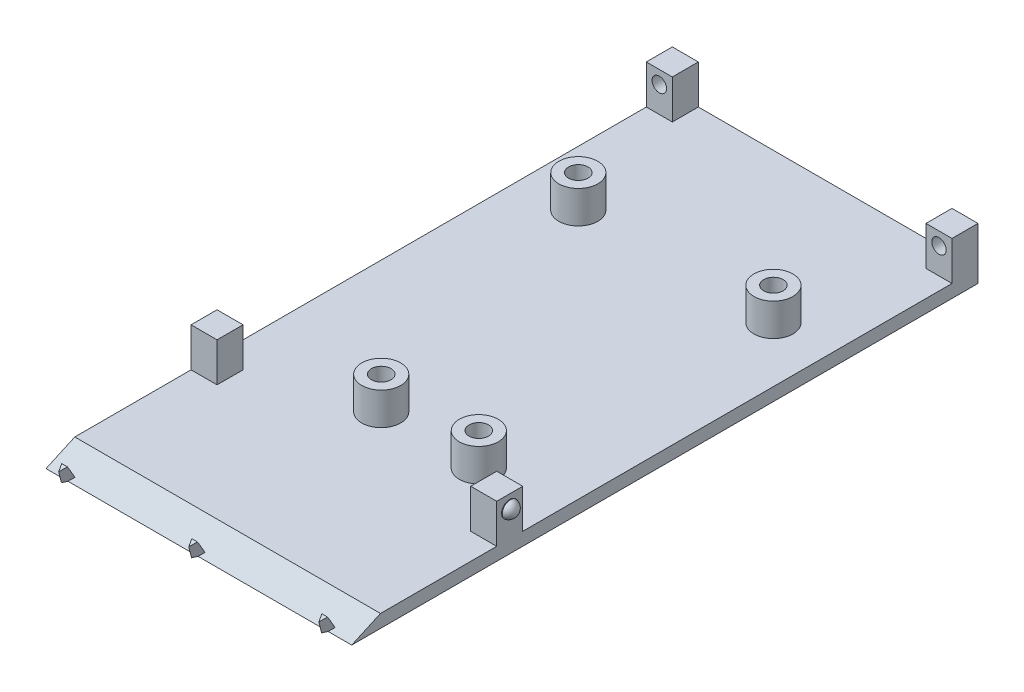
from build123d import *

# Parameters (mm, degrees)
IZIM1_W                               = 47
IZIM1_H                               = 96.3
Y_KSEKLIK_EKSTR_ZYON1_DEPTH           = 2
KES_EKSTR_ZYON1_DEPTH                 = 68.315841375
IZIM3_R                               = 3
Y_KSEKLIK_EKSTR_ZYON2_DEPTH           = 5
Y_KSEKLIK_EKSTR_ZYON3_DEPTH           = 2
Y_KSEKLIK_EKSTR_ZYON3_DRAFT           = 4
Y_KSEKLIK_EKSTR_ZYON3_PROFILE_2_DEPTH = 2
Y_KSEKLIK_EKSTR_ZYON3_PROFILE_2_DRAFT = 4
Y_KSEKLIK_EKSTR_ZYON3_PROFILE_3_DEPTH = 2
Y_KSEKLIK_EKSTR_ZYON3_PROFILE_3_DRAFT = 4
IZIM5_W                               = 47
IZIM5_H                               = 2.496748802
KES_EKSTR_ZYON3_DEPTH                 = 4
IZIM6_W                               = 4
IZIM6_H                               = 4
Y_KSEKLIK_EKSTR_ZYON4_DEPTH           = 6
IZIM7_R                               = 1.25
KES_EKSTR_ZYON4_DEPTH                 = 4
KES_EKSTR_ZYON4_DRAFT                 = -2
KES_EKSTR_ZYON4_PROFILE_2_DEPTH       = 4
KES_EKSTR_ZYON4_PROFILE_2_DRAFT       = -2
IZIM8_R                               = 1.25
Y_KSEKLIK_EKSTR_ZYON5_DEPTH           = 0.1
KUBBE5_FACE_RADIUS                    = 1.25
KUBBE5_HEIGHT                         = 1
AYNALAMA8_COPY_1_FACE_RADIUS          = 1.25
AYNALAMA8_COPY_1_HEIGHT               = 1


with BuildPart() as part:
    # Çizim1 → Yükseklik-Ekstrüzyon1 (new body)
    with BuildSketch(Plane(origin=(0, 0, 0), x_dir=(1, 0, 0), z_dir=(0, 1, 0))):
        Rectangle(IZIM1_W, IZIM1_H)
    extrude(amount=Y_KSEKLIK_EKSTR_ZYON1_DEPTH)

    # Çizim2 → Kes-Ekstrüzyon1 (cut, through all)
    with BuildSketch(Plane.ZY.offset(23.5)):
        Polygon((48.15, 0), (43.722619458, 2), (48.15, 2), align=None)
    extrude(amount=-KES_EKSTR_ZYON1_DEPTH, mode=Mode.SUBTRACT)

    # Çizim3 → Yükseklik-Ekstrüzyon2 (add)
    # profile 1 of 4: a face of its own
    with BuildSketch(Plane(origin=(0, 2, 0), x_dir=(1, 0, 0), z_dir=(0, 1, 0))):
        with Locations(Location((-15, 25.194528994, 0), (0, 0, 270))):
            Circle(IZIM3_R)
        with BuildLine():
            ThreePointArc((-16.5, 25.194528994), (-15, 23.694528994), (-13.5, 25.194528994))
            ThreePointArc((-13.5, 25.194528994), (-15, 26.694528994), (-16.5, 25.194528994))
        make_face(mode=Mode.SUBTRACT)
    # profile 2 of 4: a face of its own
    with BuildSketch(Plane(origin=(0, 2, 0), x_dir=(1, 0, 0), z_dir=(0, 1, 0))):
        with Locations(Location((15, 25.194528994, 0), (0, 0, 270))):
            Circle(IZIM3_R)
        with BuildLine():
            ThreePointArc((13.5, 25.194528994), (15, 23.694528994), (16.5, 25.194528994))
            ThreePointArc((16.5, 25.194528994), (15, 26.694528994), (13.5, 25.194528994))
        make_face(mode=Mode.SUBTRACT)
    # profile 3 of 4: a face of its own
    with BuildSketch(Plane(origin=(0, 2, 0), x_dir=(1, 0, 0), z_dir=(0, 1, 0))):
        with Locations(Location((-3.3, -16.805471006, 0), (0, 0, 270))):
            Circle(IZIM3_R)
        with BuildLine():
            ThreePointArc((-1.8, -16.805471006), (-3.3, -15.305471006), (-4.8, -16.805471006))
            ThreePointArc((-4.8, -16.805471006), (-3.3, -18.305471006), (-1.8, -16.805471006))
        make_face(mode=Mode.SUBTRACT)
    # profile 4 of 4: a face of its own
    with BuildSketch(Plane(origin=(0, 2, 0), x_dir=(1, 0, 0), z_dir=(0, 1, 0))):
        with Locations(Location((11.7, -16.805471006, 0), (0, 0, 270))):
            Circle(IZIM3_R)
        with BuildLine():
            ThreePointArc((10.2, -16.805471006), (11.7, -18.305471006), (13.2, -16.805471006))
            ThreePointArc((13.2, -16.805471006), (11.7, -15.305471006), (10.2, -16.805471006))
        make_face(mode=Mode.SUBTRACT)
    extrude(amount=Y_KSEKLIK_EKSTR_ZYON2_DEPTH)


with BuildPart() as y_kseklik_ekstr_zyon3_tool:
    # Çizim4 → Yükseklik-Ekstrüzyon3 (with draft: the straight prism first)
    with BuildSketch(Plane(origin=(0, 18.064663731, 8.160429654), x_dir=(1, 0, 0), z_dir=(0, 0.9113290688724396, 0.4116786710871625))):
        Polygon((20.223356646, -43.072925072), (18.923356646, -43.072925072), (19.573356646, -44.562410878), align=None)
    extrude(amount=Y_KSEKLIK_EKSTR_ZYON3_DEPTH)
    # Yükseklik-Ekstrüzyon3: the draft: its side faces are tilted about the plane it starts from
    y_kseklik_ekstr_zyon3_sides = [y_kseklik_ekstr_zyon3_tool.faces().sort_by_distance(p)[0] for p in [
        (19.573356646, 1.243788246, 47.825717025),
        (19.248356646, 0.937193478, 48.504422881),
        (19.898356646, 0.937193478, 48.504422881),
    ]]
    draft(y_kseklik_ekstr_zyon3_sides, Plane(origin=(0, 18.064663731, 8.160429654), x_dir=(1, 0, 0), z_dir=(0, 0.9113290688724396, 0.4116786710871625)), Y_KSEKLIK_EKSTR_ZYON3_DRAFT)


with BuildPart() as part_1:
    add(part.part)

    # Yükseklik-Ekstrüzyon3: add y_kseklik_ekstr_zyon3_tool
    add(y_kseklik_ekstr_zyon3_tool.part)


with BuildPart() as y_kseklik_ekstr_zyon3_profile_2_tool:
    # Çizim4 → Yükseklik-Ekstrüzyon3 profile 2 (with draft: the straight prism first)
    with BuildSketch(Plane(origin=(0, 18.064663731, 8.160429654), x_dir=(1, 0, 0), z_dir=(0, 0.9113290688724396, 0.4116786710871625))):
        Polygon((0.223356646, -43.072925072), (-1.076643354, -43.072925072), (-0.426643354, -44.562410878), align=None)
    extrude(amount=Y_KSEKLIK_EKSTR_ZYON3_PROFILE_2_DEPTH)
    # Yükseklik-Ekstrüzyon3 profile 2: the draft: its side faces are tilted about the plane it starts from
    y_kseklik_ekstr_zyon3_profile_2_sides = [y_kseklik_ekstr_zyon3_profile_2_tool.faces().sort_by_distance(p)[0] for p in [
        (-0.426643354, 1.243788246, 47.825717025),
        (-0.751643354, 0.937193478, 48.504422881),
        (-0.101643354, 0.937193478, 48.504422881),
    ]]
    draft(y_kseklik_ekstr_zyon3_profile_2_sides, Plane(origin=(0, 18.064663731, 8.160429654), x_dir=(1, 0, 0), z_dir=(0, 0.9113290688724396, 0.4116786710871625)), Y_KSEKLIK_EKSTR_ZYON3_PROFILE_2_DRAFT)


with BuildPart() as part_2:
    add(part_1.part)

    # Yükseklik-Ekstrüzyon3 profile 2: add y_kseklik_ekstr_zyon3_profile_2_tool
    add(y_kseklik_ekstr_zyon3_profile_2_tool.part)


with BuildPart() as y_kseklik_ekstr_zyon3_profile_3_tool:
    # Çizim4 → Yükseklik-Ekstrüzyon3 profile 3 (with draft: the straight prism first)
    with BuildSketch(Plane(origin=(0, 18.064663731, 8.160429654), x_dir=(1, 0, 0), z_dir=(0, 0.9113290688724396, 0.4116786710871625))):
        Polygon((-21.076643354, -43.072925072), (-20.426643354, -44.562410878), (-19.776643354, -43.072925072), align=None)
    extrude(amount=Y_KSEKLIK_EKSTR_ZYON3_PROFILE_3_DEPTH)
    # Yükseklik-Ekstrüzyon3 profile 3: the draft: its side faces are tilted about the plane it starts from
    y_kseklik_ekstr_zyon3_profile_3_sides = [y_kseklik_ekstr_zyon3_profile_3_tool.faces().sort_by_distance(p)[0] for p in [
        (-20.751643354, 0.937193478, 48.504422881),
        (-20.101643354, 0.937193478, 48.504422881),
        (-20.426643354, 1.243788246, 47.825717025),
    ]]
    draft(y_kseklik_ekstr_zyon3_profile_3_sides, Plane(origin=(0, 18.064663731, 8.160429654), x_dir=(1, 0, 0), z_dir=(0, 0.9113290688724396, 0.4116786710871625)), Y_KSEKLIK_EKSTR_ZYON3_PROFILE_3_DRAFT)


with BuildPart() as part_3:
    add(part_2.part)

    # Yükseklik-Ekstrüzyon3 profile 3: add y_kseklik_ekstr_zyon3_profile_3_tool
    add(y_kseklik_ekstr_zyon3_profile_3_tool.part)

    # Çizim5 → Kes-Ekstrüzyon3 (cut)
    with BuildSketch(Plane.XZ):
        with Locations((0, 49.398374401)):
            Rectangle(IZIM5_W, IZIM5_H)
    extrude(amount=KES_EKSTR_ZYON3_DEPTH, mode=Mode.SUBTRACT)

    # Çizim6 → Yükseklik-Ekstrüzyon4 (add)
    with BuildSketch(Plane(origin=(0, 2, 0), x_dir=(1, 0, 0), z_dir=(0, 1, 0))):
        with Locations((-21.5, 46.15)):
            Rectangle(IZIM6_W, IZIM6_H)
        with Locations((21.5, 46.15)):
            Rectangle(IZIM6_W, IZIM6_H)
        with Locations((-21.5, -23.85)):
            Rectangle(IZIM6_W, IZIM6_H)
        with Locations((21.5, -23.85)):
            Rectangle(IZIM6_W, IZIM6_H)
    extrude(amount=Y_KSEKLIK_EKSTR_ZYON4_DEPTH)


with BuildPart() as kes_ekstr_zyon4_tool:
    # Çizim7 → Kes-Ekstrüzyon4 (with draft: the straight prism first)
    with BuildSketch(Plane(origin=(0, 0, -48.15), x_dir=(-1, 0, 0), z_dir=(0, 0, -1))):
        with Locations((-21.5, 6)):
            Circle(IZIM7_R)
    extrude(amount=-KES_EKSTR_ZYON4_DEPTH)
    # Kes-Ekstrüzyon4: the draft: its side faces are tilted about the plane it starts from
    kes_ekstr_zyon4_sides = [kes_ekstr_zyon4_tool.faces().sort_by_distance(p)[0] for p in [
        (22.75, 6, -46.15),
    ]]
    draft(kes_ekstr_zyon4_sides, Plane(origin=(0, 0, -48.15), x_dir=(-1, 0, 0), z_dir=(0, 0, -1)), KES_EKSTR_ZYON4_DRAFT)


with BuildPart() as part_4:
    add(part_3.part)

    # Kes-Ekstrüzyon4: cut by kes_ekstr_zyon4_tool
    add(kes_ekstr_zyon4_tool.part, mode=Mode.SUBTRACT)


with BuildPart() as kes_ekstr_zyon4_profile_2_tool:
    # Çizim7 → Kes-Ekstrüzyon4 profile 2 (with draft: the straight prism first)
    with BuildSketch(Plane(origin=(0, 0, -48.15), x_dir=(-1, 0, 0), z_dir=(0, 0, -1))):
        with Locations((21.5, 6)):
            Circle(IZIM7_R)
    extrude(amount=-KES_EKSTR_ZYON4_PROFILE_2_DEPTH)
    # Kes-Ekstrüzyon4 profile 2: the draft: its side faces are tilted about the plane it starts from
    kes_ekstr_zyon4_profile_2_sides = [kes_ekstr_zyon4_profile_2_tool.faces().sort_by_distance(p)[0] for p in [
        (-20.25, 6, -46.15),
    ]]
    draft(kes_ekstr_zyon4_profile_2_sides, Plane(origin=(0, 0, -48.15), x_dir=(-1, 0, 0), z_dir=(0, 0, -1)), KES_EKSTR_ZYON4_PROFILE_2_DRAFT)


with BuildPart() as part_5:
    add(part_4.part)

    # Kes-Ekstrüzyon4 profile 2: cut by kes_ekstr_zyon4_profile_2_tool
    add(kes_ekstr_zyon4_profile_2_tool.part, mode=Mode.SUBTRACT)

    # Çizim8 → Yükseklik-Ekstrüzyon5 (add)
    with BuildSketch(Plane.ZY.offset(23.5)):
        with Locations(Location((23.85, 6, 0), (0, 0, 180))):
            Circle(IZIM8_R)
    y_kseklik_ekstr_zyon5 = extrude(amount=Y_KSEKLIK_EKSTR_ZYON5_DEPTH)

    # Kubbe5: a dome of height H over a round flat face of radius A is a cap of a sphere of radius (A * A + H * H) / (2 * H)
    kubbe5_r = (KUBBE5_FACE_RADIUS * KUBBE5_FACE_RADIUS + KUBBE5_HEIGHT * KUBBE5_HEIGHT) / (2 * KUBBE5_HEIGHT)
    kubbe5_base = Plane((-23.6, 6, 23.85), z_dir=(-1, 0, 0))
    with Locations(kubbe5_base.offset(KUBBE5_HEIGHT - kubbe5_r)):
        kubbe5_ball = Sphere(kubbe5_r, mode=Mode.PRIVATE)
    add(split(kubbe5_ball, bisect_by=kubbe5_base, keep=Keep.TOP, mode=Mode.PRIVATE))

    # Aynalama8: Yükseklik-Ekstrüzyon5 across plane
    add(y_kseklik_ekstr_zyon5.mirror(Plane(origin=(0, 0, 0), x_dir=(0, 0, 1), z_dir=(1, 0, 0))))

    # Aynalama8 copy 1: a dome of height H over a round flat face of radius A is a cap of a sphere of radius (A * A + H * H) / (2 * H)
    aynalama8_copy_1_r = (AYNALAMA8_COPY_1_FACE_RADIUS * AYNALAMA8_COPY_1_FACE_RADIUS + AYNALAMA8_COPY_1_HEIGHT * AYNALAMA8_COPY_1_HEIGHT) / (2 * AYNALAMA8_COPY_1_HEIGHT)
    aynalama8_copy_1_base = Plane((23.6, 6, 23.85), z_dir=(1, 0, 0))
    with Locations(aynalama8_copy_1_base.offset(AYNALAMA8_COPY_1_HEIGHT - aynalama8_copy_1_r)):
        aynalama8_copy_1_ball = Sphere(aynalama8_copy_1_r, mode=Mode.PRIVATE)
    add(split(aynalama8_copy_1_ball, bisect_by=aynalama8_copy_1_base, keep=Keep.TOP, mode=Mode.PRIVATE))


solid = part_5.part
